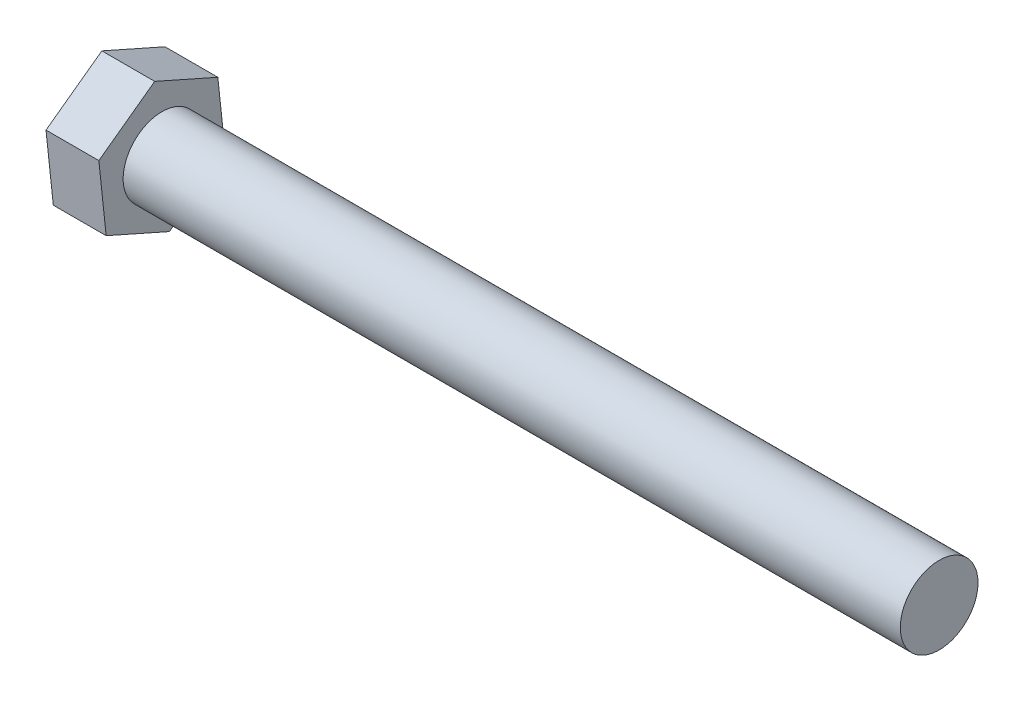
from build123d import *

# Parameters (mm, degrees)
BOSS_EXTRUDE1_DEPTH = 3.4
SKETCH2_R           = 2.5
BOSS_EXTRUDE2_DEPTH = 50


with BuildPart() as part:
    # Sketch1 → Boss-Extrude1 (new body)
    with BuildSketch(Plane(origin=(0, 0, 0), x_dir=(0, 0, -1), z_dir=(1, 0, 0))):
        Polygon((3.593546063, 2.617204621), (-0.469792657, 4.420704491), (-4.06333872, 1.80349987), (-3.593546063, -2.617204621), (0.469792657, -4.420704491), (4.06333872, -1.80349987), align=None)
    extrude(amount=BOSS_EXTRUDE1_DEPTH)

    # Sketch2 → Boss-Extrude2 (add)
    with BuildSketch(Plane(origin=(3.4, 0, 0), x_dir=(0, 0, -1), z_dir=(1, 0, 0))):
        Circle(SKETCH2_R)
    extrude(amount=BOSS_EXTRUDE2_DEPTH)


solid = part.part
